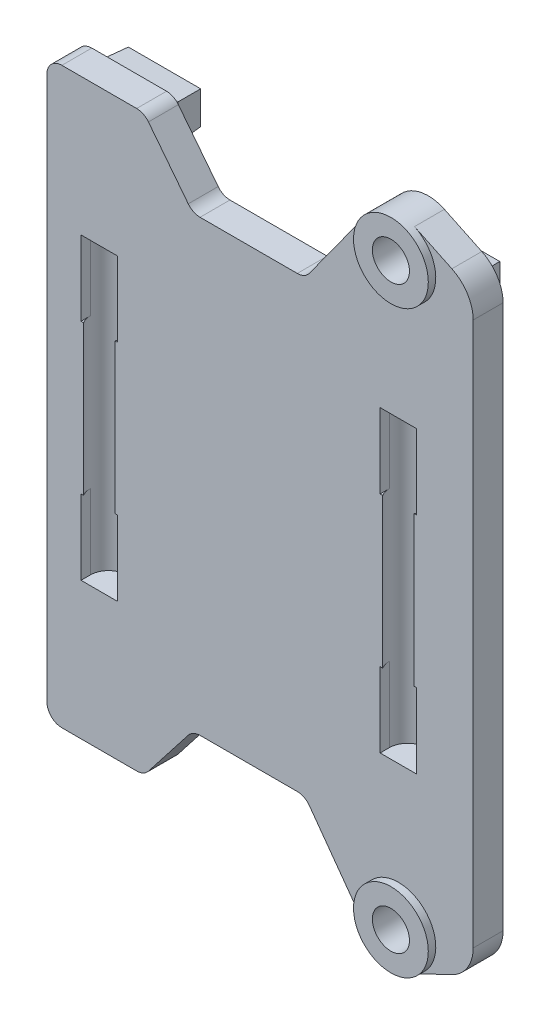
from build123d import *

# Parameters (mm, degrees)
SKETCH2_R                     = 1.575
BOSS_EXTRUDE1_DEPTH           = 2.54
SKETCH3_R                     = 3.175
SKETCH3_R_2                   = 1.575
BOSS_EXTRUDE2_DEPTH           = 0.635
SKETCH4_W                     = 6.35
SKETCH4_H                     = 3
BOSS_EXTRUDE3_DEPTH           = 1
SKETCH5_W                     = 6.35
SKETCH5_H                     = 3
BOSS_EXTRUDE4_DEPTH           = 2
BOSS_EXTRUDE4_DRAFT           = 3
BOSS_EXTRUDE4_PROFILE_2_DEPTH = 2
BOSS_EXTRUDE4_PROFILE_2_DRAFT = 3
SKETCH6_R                     = 1.55
CUT_EXTRUDE1_DEPTH            = 12.7
CUT_EXTRUDE2_START            = -0.788
SKETCH7_W                     = 3.1
SKETCH7_H                     = 6.35
CUT_EXTRUDE2_DEPTH            = 0.788
CUT_EXTRUDE3_REACH            = 194.595
SKETCH8_W                     = 1.27
SKETCH8_H                     = 6.35
LPATTERN1_COUNT               = 2
LPATTERN1_PITCH               = 25.4


with BuildPart() as part:
    # Sketch2 → Boss-Extrude1 (new body)
    with BuildSketch(Plane.XY):
        with BuildLine():
            Line((185.518234548, 27.471308328), (188.693234548, 25.955058328))
            ThreePointArc((188.693234548, 25.955058328), (190.010588361, 24.783587953), (190.5, 23.09))
            Line((190.5, 23.09), (190.5, 0))
            Line((190.5, 0), (154.305, 0))
            Line((154.305, 0), (154.305, 23.09))
            ThreePointArc((154.305, 23.09), (154.676974388, 23.988025612), (155.575, 24.36))
            Line((155.575, 24.36), (161.925, 24.36))
            ThreePointArc((161.925, 24.36), (162.482139282, 24.23126939), (162.926332297, 23.871174521))
            Line((162.926332297, 23.871174521), (166.306150062, 19.538825479))
            ThreePointArc((166.306150062, 19.538825479), (166.750343077, 19.17873061), (167.307482358, 19.05))
            Line((167.307482358, 19.05), (175.563715168, 19.05))
            ThreePointArc((175.563715168, 19.05), (176.141475824, 19.189030228), (176.592738534, 19.575680906))
            Line((176.592738534, 19.575680906), (181.577441586, 26.467047734))
            ThreePointArc((181.577441586, 26.467047734), (183.365950366, 27.682918843), (185.518234548, 27.471308328))
        make_face()
        with Locations((184.15, 24.60625)):
            Circle(SKETCH2_R, mode=Mode.SUBTRACT)
    extrude(amount=BOSS_EXTRUDE1_DEPTH)

    # Sketch3 → Boss-Extrude2 (add)
    with BuildSketch(Plane.XY.offset(2.54)):
        with Locations(Location((184.15, 24.60625, 0), (0, 0, 144.120815799))):
            Circle(SKETCH3_R)
        with Locations((184.15, 24.60625)):
            Circle(SKETCH3_R_2, mode=Mode.SUBTRACT)
    extrude(amount=BOSS_EXTRUDE2_DEPTH)

    # Sketch4 → Boss-Extrude3 (add)
    with BuildSketch(Plane(origin=(0, 0, 0), x_dir=(-1, 0, 0), z_dir=(0, 0, -1))):
        with Locations((-184.15, 21.59)):
            Rectangle(SKETCH4_W, SKETCH4_H)
        with Locations((-158.75, 21.59)):
            Rectangle(SKETCH4_W, SKETCH4_H)
    extrude(amount=BOSS_EXTRUDE3_DEPTH)


with BuildPart() as boss_extrude4_tool:
    # Sketch5 → Boss-Extrude4 (with draft: the straight prism first)
    with BuildSketch(Plane(origin=(0, 0, -1), x_dir=(-1, 0, 0), z_dir=(0, 0, -1))):
        with Locations((-158.75, 21.59)):
            Rectangle(SKETCH5_W, SKETCH5_H)
    extrude(amount=BOSS_EXTRUDE4_DEPTH)
    # Boss-Extrude4: the draft: its side faces are tilted about the plane it starts from
    boss_extrude4_sides = [boss_extrude4_tool.faces().sort_by_distance(p)[0] for p in [
        (155.575, 21.59, -2),
        (158.75, 23.09, -2),
        (161.925, 21.59, -2),
        (158.75, 20.09, -2),
    ]]
    draft(boss_extrude4_sides, Plane(origin=(0, 0, -1), x_dir=(-1, 0, 0), z_dir=(0, 0, -1)), BOSS_EXTRUDE4_DRAFT)


with BuildPart() as part_1:
    add(part.part)

    # Boss-Extrude4: add boss_extrude4_tool
    add(boss_extrude4_tool.part)


with BuildPart() as boss_extrude4_profile_2_tool:
    # Sketch5 → Boss-Extrude4 profile 2 (with draft: the straight prism first)
    with BuildSketch(Plane(origin=(0, 0, -1), x_dir=(-1, 0, 0), z_dir=(0, 0, -1))):
        with Locations((-184.15, 21.59)):
            Rectangle(SKETCH5_W, SKETCH5_H)
    extrude(amount=BOSS_EXTRUDE4_PROFILE_2_DEPTH)
    # Boss-Extrude4 profile 2: the draft: its side faces are tilted about the plane it starts from
    boss_extrude4_profile_2_sides = [boss_extrude4_profile_2_tool.faces().sort_by_distance(p)[0] for p in [
        (180.975, 21.59, -2),
        (184.15, 23.09, -2),
        (187.325, 21.59, -2),
        (184.15, 20.09, -2),
    ]]
    draft(boss_extrude4_profile_2_sides, Plane(origin=(0, 0, -1), x_dir=(-1, 0, 0), z_dir=(0, 0, -1)), BOSS_EXTRUDE4_PROFILE_2_DRAFT)


with BuildPart() as part_2:
    add(part_1.part)

    # Boss-Extrude4 profile 2: add boss_extrude4_profile_2_tool
    add(boss_extrude4_profile_2_tool.part)

    # Sketch6 → Cut-Extrude1 (cut)
    with BuildSketch(Plane.XZ):
        with Locations((184.15, 1.752)):
            Circle(SKETCH6_R)
    cut_extrude1 = extrude(amount=-CUT_EXTRUDE1_DEPTH, mode=Mode.SUBTRACT)

    # Sketch7 → Cut-Extrude2 (cut)
    with BuildSketch(Plane.XY.offset(2.54).offset(CUT_EXTRUDE2_START)):
        with Locations((184.15, 9.525)):
            Rectangle(SKETCH7_W, SKETCH7_H)
    cut_extrude2 = extrude(amount=CUT_EXTRUDE2_DEPTH, mode=Mode.SUBTRACT)

    # Sketch8 → Cut-Extrude3 (cut, up to next)
    with BuildSketch(Plane.XY.offset(2.54), mode=Mode.PRIVATE) as cut_extrude3_sk1:
        with Locations((184.15, 3.175)):
            Rectangle(SKETCH8_W, SKETCH8_H)
    cut_extrude3_tool1 = extrude(cut_extrude3_sk1.sketch, amount=-CUT_EXTRUDE3_REACH, mode=Mode.PRIVATE) & part_2.part
    cut_extrude3 = cut_extrude3_tool1.solids().sort_by_distance((184.15, 3.175, 2.54))[0]
    add(cut_extrude3, mode=Mode.SUBTRACT)

    # LPattern1: Cut-Extrude1, Cut-Extrude2, Cut-Extrude3 ×2
    with Locations(*[(-i * LPATTERN1_PITCH, 0, 0) for i in range(1, LPATTERN1_COUNT)]):
        add(cut_extrude1, mode=Mode.SUBTRACT)
        add(cut_extrude2, mode=Mode.SUBTRACT)
        add(cut_extrude3, mode=Mode.SUBTRACT)

    # Mirror1: part across plane


with BuildPart() as part_3:
    add(part_2.part)
    add(part_2.part.mirror(Plane.ZX))


solid = part_3.part
